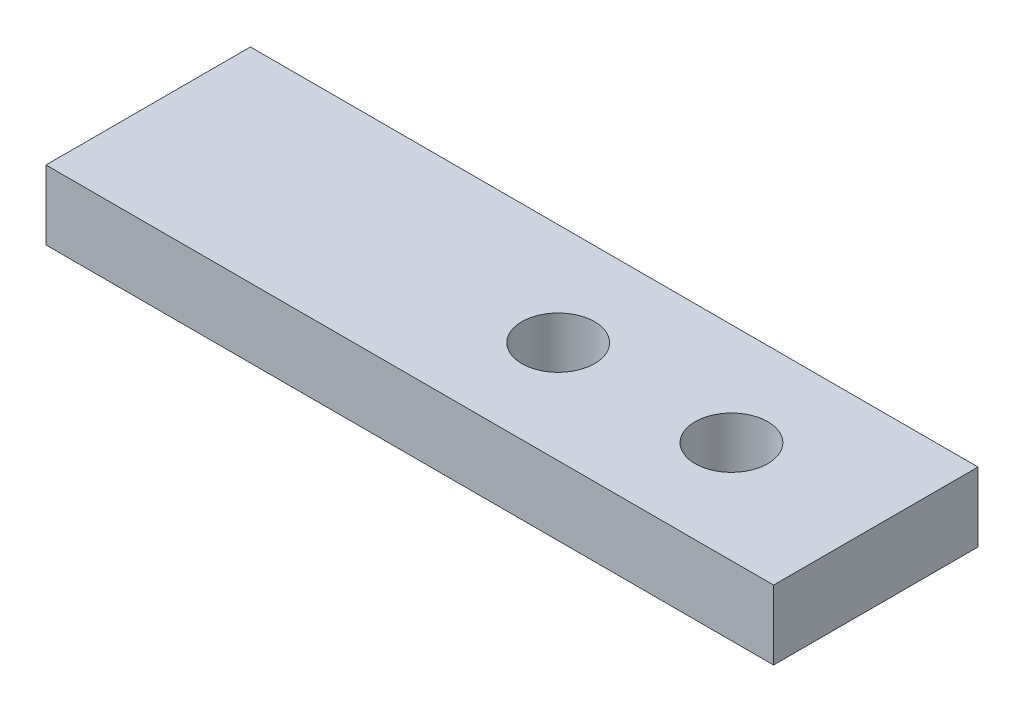
from build123d import *

# Parameters (mm, degrees)
SKETCH1_W           = 32.004
SKETCH1_H           = 8.9916
SKETCH1_R           = 1.6002
BOSS_EXTRUDE1_DEPTH = 3.048


with BuildPart() as part:
    # Sketch1 → Boss-Extrude1 (new body)
    with BuildSketch(Plane(origin=(0, 0, 0), x_dir=(1, 0, 0), z_dir=(0, 1, 0))):
        Rectangle(SKETCH1_W, SKETCH1_H)
        with Locations(Location((9.652, 0, 0), (0, 0, 90))):
            Circle(SKETCH1_R, mode=Mode.SUBTRACT)
        with Locations(Location((2.032, 0, 0), (0, 0, 90))):
            Circle(SKETCH1_R, mode=Mode.SUBTRACT)
    extrude(amount=BOSS_EXTRUDE1_DEPTH)


solid = part.part
